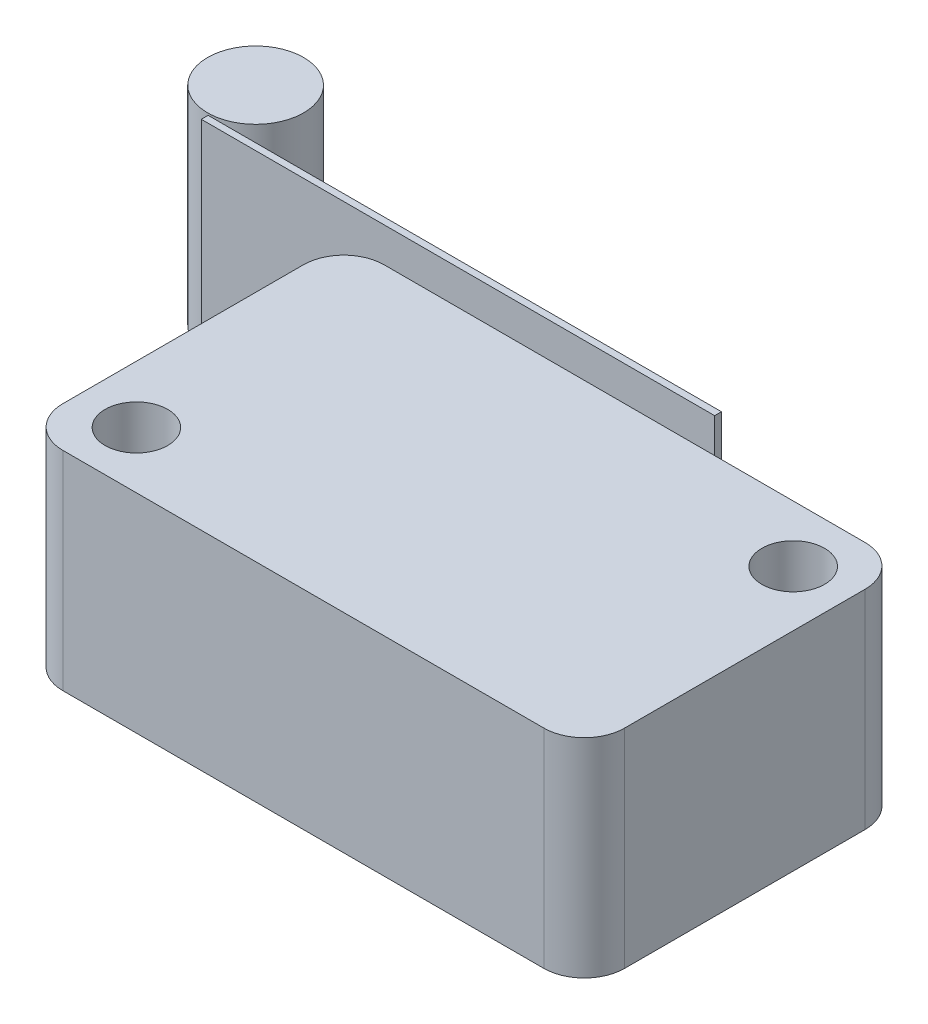
from build123d import *

# Parameters (mm, degrees)
SKETCH1_W           = 27.8
SKETCH1_H           = 15.9
SKETCH1_R           = 1.55
BOSS_EXTRUDE1_DEPTH = 10.3
FILLET1_R           = 2
SKETCH2_W           = 25.4
SKETCH2_H           = 0.337095458
BOSS_EXTRUDE2_DEPTH = 10.3
SKETCH3_R           = 2.375
BOSS_EXTRUDE3_DEPTH = 10.3


with BuildPart() as part:
    # Sketch1 → Boss-Extrude1 (new body)
    with BuildSketch(Plane(origin=(0, 0, 0), x_dir=(1, 0, 0), z_dir=(0, 1, 0))):
        with Locations((-0.477504057, 0.273104838)):
            Rectangle(SKETCH1_W, SKETCH1_H)
        with Locations(Location((10.662060344, 5.423104838, 0), (0, 0, 90))):
            Circle(SKETCH1_R, mode=Mode.SUBTRACT)
        with Locations(Location((-11.537939656, -4.876895162, 0), (0, 0, 90))):
            Circle(SKETCH1_R, mode=Mode.SUBTRACT)
    extrude(amount=BOSS_EXTRUDE1_DEPTH)

    # Fillet1
    fillet1_edges = [part.edges().sort_by_distance(p)[0] for p in [
        (-14.377504057, 5.15, -8.223104838),
        (13.422495943, 5.15, -8.223104838),
        (13.422495943, 5.15, 7.676895162),
        (-14.377504057, 5.15, 7.676895162),
    ]]
    fillet(fillet1_edges, radius=FILLET1_R)


with BuildPart() as body_2:
    # Sketch2 → Boss-Extrude2 (new body)
    with BuildSketch(Plane(origin=(0, 10.3, 0), x_dir=(1, 0, 0), z_dir=(0, 1, 0))):
        with Locations((-10.437939656, 10.104131828)):
            Rectangle(SKETCH2_W, SKETCH2_H)
    extrude(amount=-BOSS_EXTRUDE2_DEPTH)


with BuildPart() as body_3:
    # Sketch3 → Boss-Extrude3 (new body)
    with BuildSketch(Plane(origin=(-46.217462662, 0, 0), x_dir=(-1, 0, 0), z_dir=(0, -1, 0))):
        with Locations(Location((-22.960225011, 12.74171273, 0), (0, 0, 90))):
            Circle(SKETCH3_R)
    extrude(amount=-BOSS_EXTRUDE3_DEPTH)


solid = Compound([part.part, body_2.part, body_3.part])
